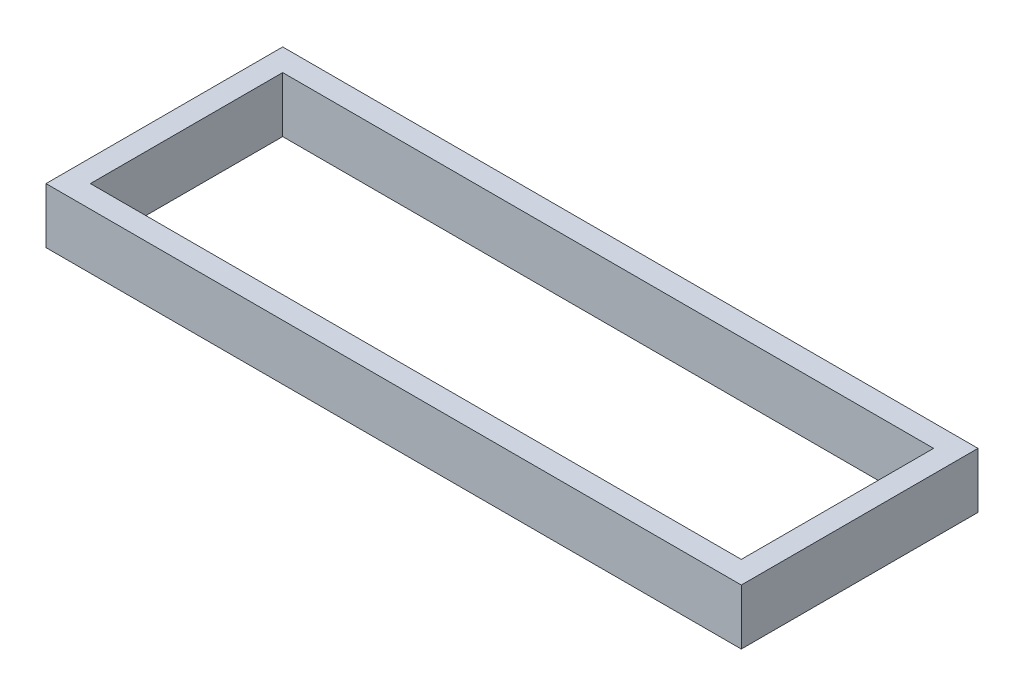
from build123d import *

# Parameters (mm, degrees)
SKETCH1_W           = 188
SKETCH1_H           = 64
SKETCH1_W_2         = 176
SKETCH1_H_2         = 52
BOSS_EXTRUDE1_DEPTH = 15


with BuildPart() as part:
    # Sketch1 → Boss-Extrude1 (new body)
    with BuildSketch(Plane(origin=(0, 0, 0), x_dir=(1, 0, 0), z_dir=(0, 1, 0))):
        Rectangle(SKETCH1_W, SKETCH1_H)
        Rectangle(SKETCH1_W_2, SKETCH1_H_2, mode=Mode.SUBTRACT)
    extrude(amount=BOSS_EXTRUDE1_DEPTH)


solid = part.part
